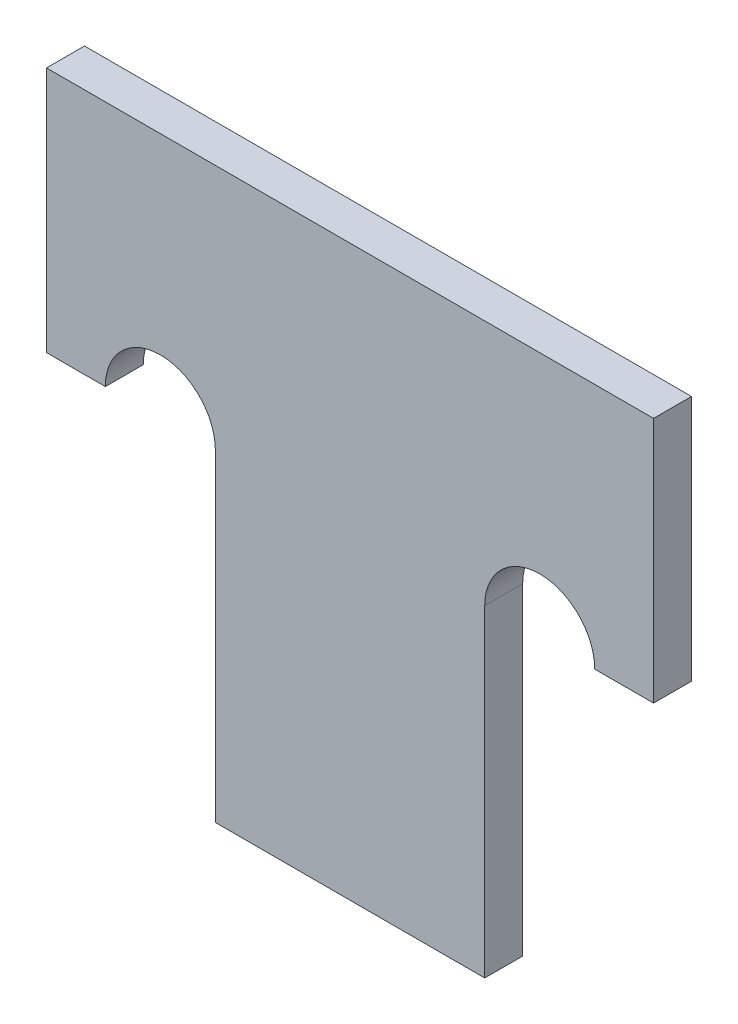
from build123d import *

# Parameters (mm, degrees)
SKETCH1_W           = 40.64
SKETCH1_H           = 38.1
SKETCH1_R           = 3.175
BOSS_EXTRUDE1_DEPTH = 2.54
CUT_EXTRUDE1_DEPTH  = 2.54


with BuildPart() as part:
    # Sketch1 → Boss-Extrude1 (new body)
    with BuildSketch(Plane.XY):
        Rectangle(SKETCH1_W, SKETCH1_H)
        with Locations((12.7, 2.54)):
            Circle(SKETCH1_R, mode=Mode.SUBTRACT)
        with Locations(Location((-12.7, 2.54, 0), (0, 0, 180))):
            Circle(SKETCH1_R, mode=Mode.SUBTRACT)
    extrude(amount=BOSS_EXTRUDE1_DEPTH)

    # Sketch2 → Cut-Extrude1 (cut)
    with BuildSketch(Plane.XY):
        with BuildLine():
            Line((9.017, 2.54), (9.017, -19.05))
            Line((9.017, -19.05), (20.32, -19.05))
            Line((20.32, -19.05), (20.32, 2.54))
            Line((20.32, 2.54), (16.383, 2.54))
            ThreePointArc((16.383, 2.54), (12.7, 6.223), (9.017, 2.54))
        make_face()
        with BuildLine():
            Line((-9.017, 2.54), (-9.017, -19.05))
            Line((-9.017, -19.05), (-20.32, -19.05))
            Line((-20.32, -19.05), (-20.32, 2.54))
            Line((-20.32, 2.54), (-16.383, 2.54))
            ThreePointArc((-16.383, 2.54), (-12.7, 6.223), (-9.017, 2.54))
        make_face()
    extrude(amount=CUT_EXTRUDE1_DEPTH, mode=Mode.SUBTRACT)


solid = part.part
